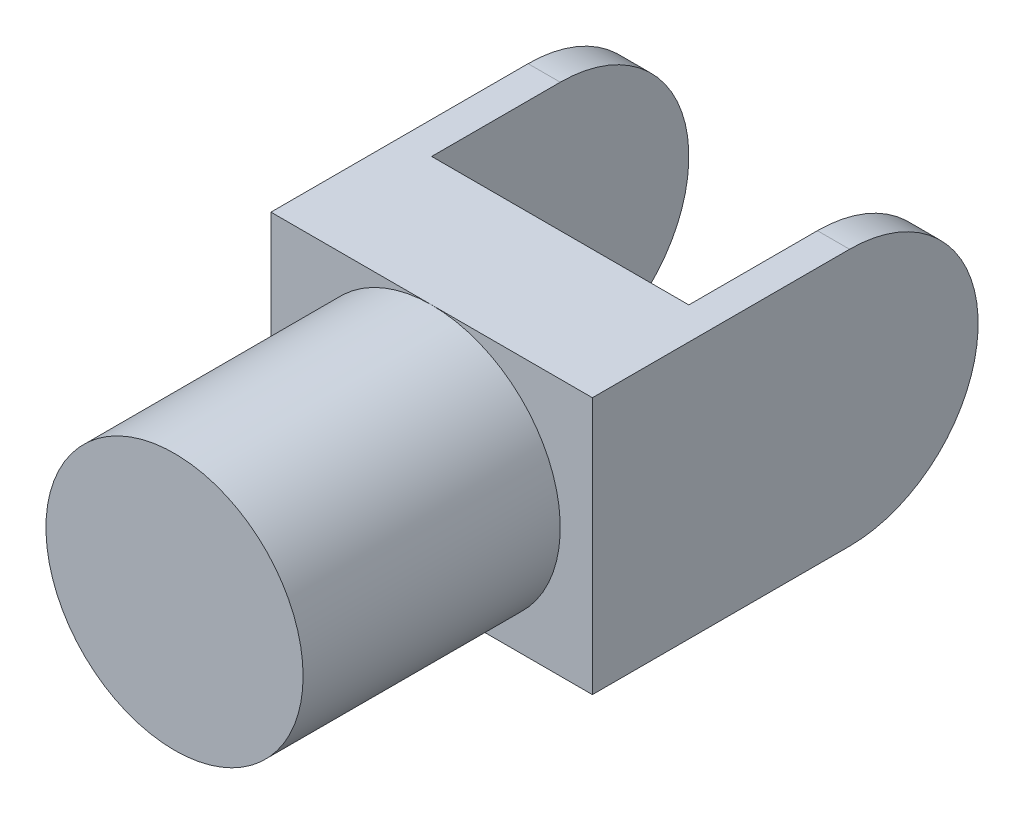
from build123d import *

# Parameters (mm, degrees)
BOSS_EXTRUDE1_DEPTH = 100
SKETCH2_W           = 80
SKETCH2_H           = 80
CUT_EXTRUDE1_DEPTH  = 100
SKETCH3_R           = 40
BOSS_EXTRUDE2_DEPTH = 80


with BuildPart() as part:
    # Sketch1 → Boss-Extrude1 (new body)
    with BuildSketch(Plane(origin=(0, 0, 0), x_dir=(0, 0, -1), z_dir=(1, 0, 0))):
        with BuildLine():
            Line((0, 40), (-80, 40))
            Line((-80, 40), (-80, -40))
            Line((-80, -40), (0, -40))
            ThreePointArc((0, -40), (40, 0), (0, 40))
        make_face()
    extrude(amount=BOSS_EXTRUDE1_DEPTH)

    # Sketch2 → Cut-Extrude1 (cut)
    with BuildSketch(Plane(origin=(0, 40, 0), x_dir=(1, 0, 0), z_dir=(0, 1, 0))):
        with Locations((50, 0)):
            Rectangle(SKETCH2_W, SKETCH2_H)
    extrude(amount=-CUT_EXTRUDE1_DEPTH, mode=Mode.SUBTRACT)

    # Sketch3 → Boss-Extrude2 (add)
    with BuildSketch(Plane.XY.offset(80)):
        with Locations(Location((50, 0, 0), (0, 0, 270))):
            Circle(SKETCH3_R)
    extrude(amount=BOSS_EXTRUDE2_DEPTH)


solid = part.part
